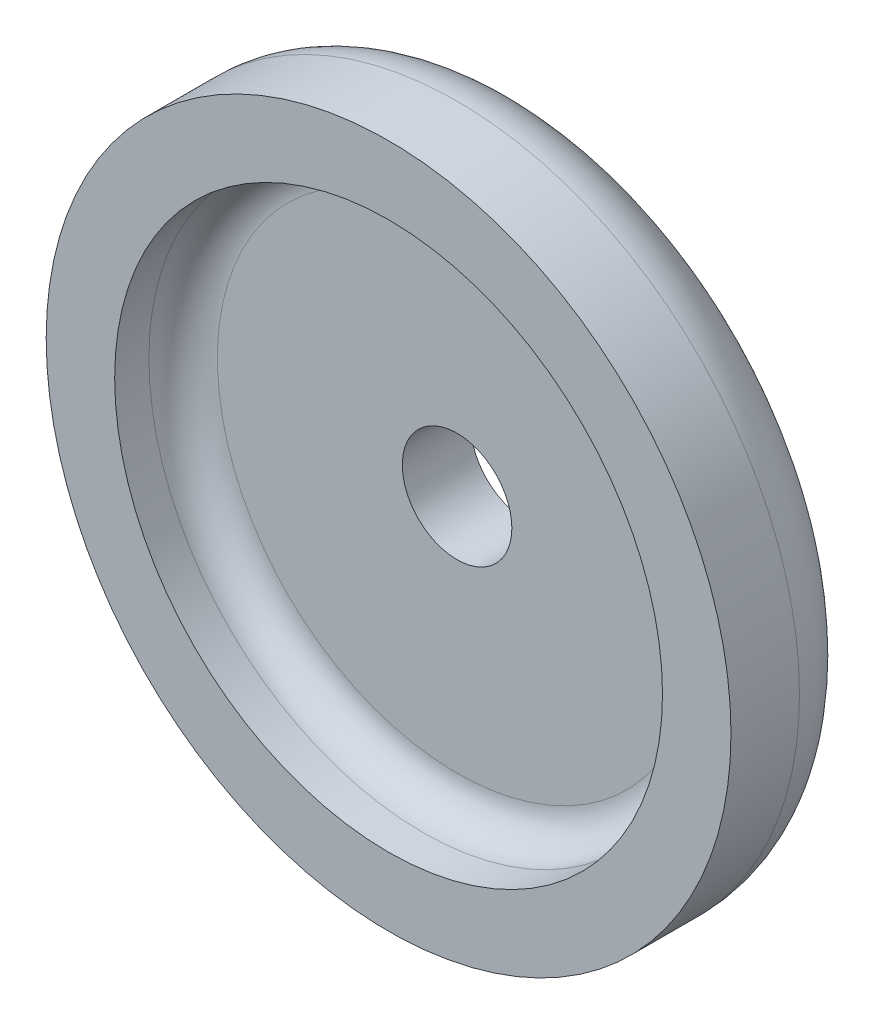
from build123d import *

# Parameters (mm, degrees)
SKETCH_1_R             = 5
EXTRUDE_1_DEPTH        = 2
SHELL_1_T              = -1
FILLET_1_R             = 0.5
FILLET_2_R             = 1
HOLE_WIZARD_M2_1_D     = 1.6
HOLE_WIZARD_M2_1_DEPTH = 5.2
HOLE_WIZARD_M2_1_TIP   = 0.480688495


with BuildPart() as part:
    # 草图1 → 凸台-拉伸1 (new body)
    with BuildSketch(Plane.XY):
        Circle(SKETCH_1_R)
    extrude(amount=EXTRUDE_1_DEPTH)

    # 抽壳1
    shell_1_openings = [part.faces().sort_by_distance(p)[0] for p in [
        (0, 0, 2),
    ]]
    offset(amount=SHELL_1_T, openings=shell_1_openings, kind=Kind.INTERSECTION)

    # 圆角1
    fillet_1_edges = [part.edges().sort_by_distance(p)[0] for p in [
        (-4, 0, 1),
    ]]
    fillet(fillet_1_edges, radius=FILLET_1_R)

    # 圆角2
    fillet_2_edges = [part.edges().sort_by_distance(p)[0] for p in [
        (-5, 0, 0),
    ]]
    fillet(fillet_2_edges, radius=FILLET_2_R)

    # M2 螺纹孔1
    with Locations(Plane.XY.offset(1)):
        with Locations((0, 0)):
            Hole(HOLE_WIZARD_M2_1_D / 2, depth=HOLE_WIZARD_M2_1_DEPTH)
            with Locations((0, 0, -(HOLE_WIZARD_M2_1_DEPTH + HOLE_WIZARD_M2_1_TIP / 2))):  # 118° drill point
                Cone(0, HOLE_WIZARD_M2_1_D / 2, HOLE_WIZARD_M2_1_TIP, mode=Mode.SUBTRACT)


solid = part.part
